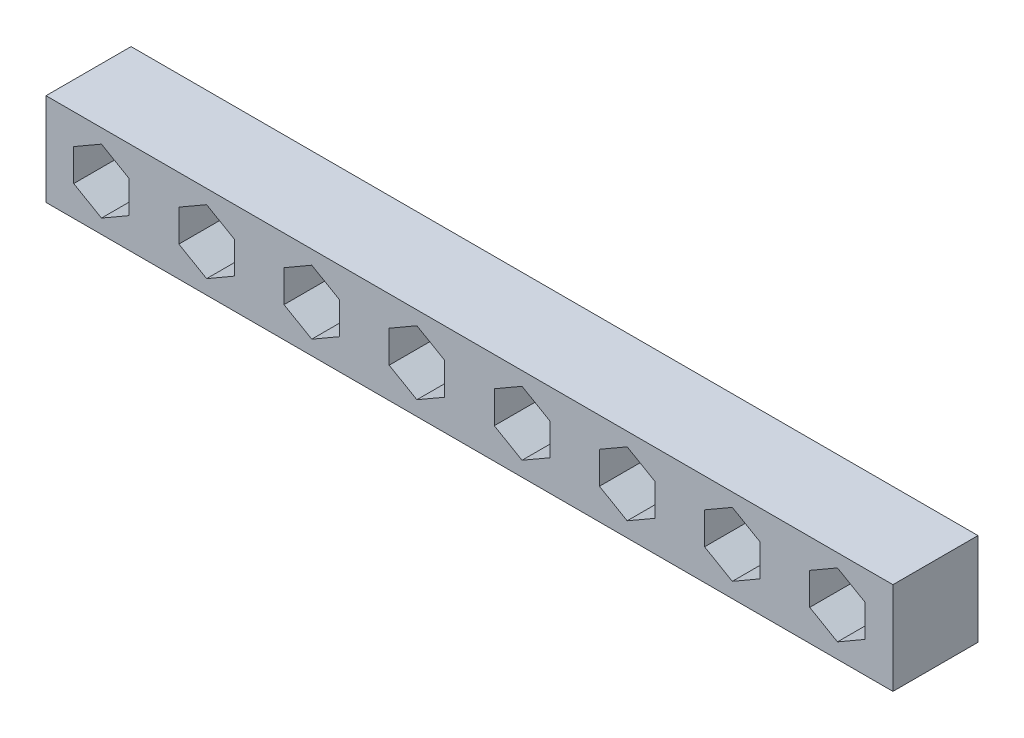
from build123d import *

# Parameters (mm, degrees)
SKETCH1_W           = 229
SKETCH1_H           = 25
BOSS_EXTRUDE1_DEPTH = 23
CUT_EXTRUDE1_DEPTH  = 23


with BuildPart() as part:
    # Sketch1 → Boss-Extrude1 (new body)
    with BuildSketch(Plane.XY):
        with Locations((114.5, 12.5)):
            Rectangle(SKETCH1_W, SKETCH1_H)
    extrude(amount=BOSS_EXTRUDE1_DEPTH)

    # Sketch2 → Cut-Extrude1 (cut)
    with BuildSketch(Plane.XY.offset(23)):
        Polygon((43.428571429, 21.197944284), (35.928571429, 16.867817265), (35.928571429, 8.207563227), (43.428571429, 3.877436208), (50.928571429, 8.207563227), (50.928571429, 16.867817265), align=None)
        Polygon((15, 3.839745962), (22.5, 8.169872981), (22.5, 16.830127019), (15, 21.160254038), (7.5, 16.830127019), (7.5, 8.169872981), align=None)
        Polygon((71.857142857, 21.235634529), (64.357142857, 16.90550751), (64.357142857, 8.245253472), (71.857142857, 3.915126454), (79.357142857, 8.245253472), (79.357142857, 16.90550751), align=None)
        Polygon((100.285714286, 21.273324775), (92.785714286, 16.943197756), (92.785714286, 8.282943718), (100.285714286, 3.952816699), (107.785714286, 8.282943718), (107.785714286, 16.943197756), align=None)
        Polygon((128.714285714, 21.311015021), (121.214285714, 16.980888002), (121.214285714, 8.320633964), (128.714285714, 3.990506945), (136.214285714, 8.320633964), (136.214285714, 16.980888002), align=None)
        Polygon((157.142857143, 21.348705266), (149.642857143, 17.018578247), (149.642857143, 8.358324209), (157.142857143, 4.028197191), (164.642857143, 8.358324209), (164.642857143, 17.018578247), align=None)
        Polygon((185.571428571, 21.386395512), (178.071428571, 17.056268493), (178.071428571, 8.396014455), (185.571428571, 4.065887436), (193.071428571, 8.396014455), (193.071428571, 17.056268493), align=None)
        Polygon((214, 21.424085758), (206.5, 17.093958739), (206.5, 8.433704701), (214, 4.103577682), (221.5, 8.433704701), (221.5, 17.093958739), align=None)
    extrude(amount=-CUT_EXTRUDE1_DEPTH, mode=Mode.SUBTRACT)


solid = part.part
